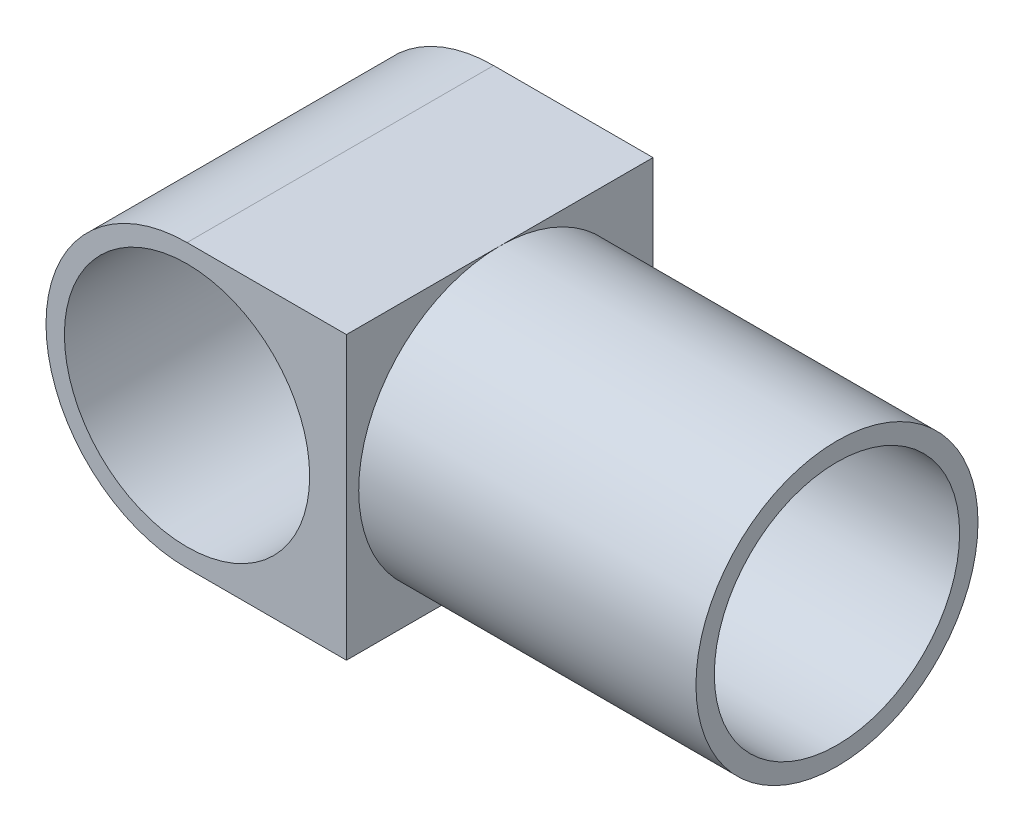
from build123d import *

# Parameters (mm, degrees)
SZKIC1_R                    = 10
DODANIE_WYCI_GNI_CIE1_DEPTH = 25
SZKIC2_R                    = 11.5
SZKIC2_R_2                  = 10
DODANIE_WYCI_GNI_CIE2_DEPTH = 27.5


with BuildPart() as part:
    # Szkic1 → Dodanie-wyciągnięcie1 (new body)
    with BuildSketch(Plane.XY):
        with BuildLine():
            Line((0, 11.5), (13, 11.5))
            Line((13, 11.5), (13, -11.5))
            Line((13, -11.5), (0, -11.5))
            ThreePointArc((0, -11.5), (-11.5, 0), (0, 11.5))
        make_face()
        Circle(SZKIC1_R, mode=Mode.SUBTRACT)
    extrude(amount=DODANIE_WYCI_GNI_CIE1_DEPTH)

    # Szkic2 → Dodanie-wyciągnięcie2 (add)
    with BuildSketch(Plane(origin=(13, 0, 0), x_dir=(0, 0, -1), z_dir=(1, 0, 0))):
        with Locations(Location((-12.5, 0, 0), (0, 0, 270))):
            Circle(SZKIC2_R)
        with Locations((-12.5, 0)):
            Circle(SZKIC2_R_2, mode=Mode.SUBTRACT)
    extrude(amount=DODANIE_WYCI_GNI_CIE2_DEPTH)


solid = part.part
